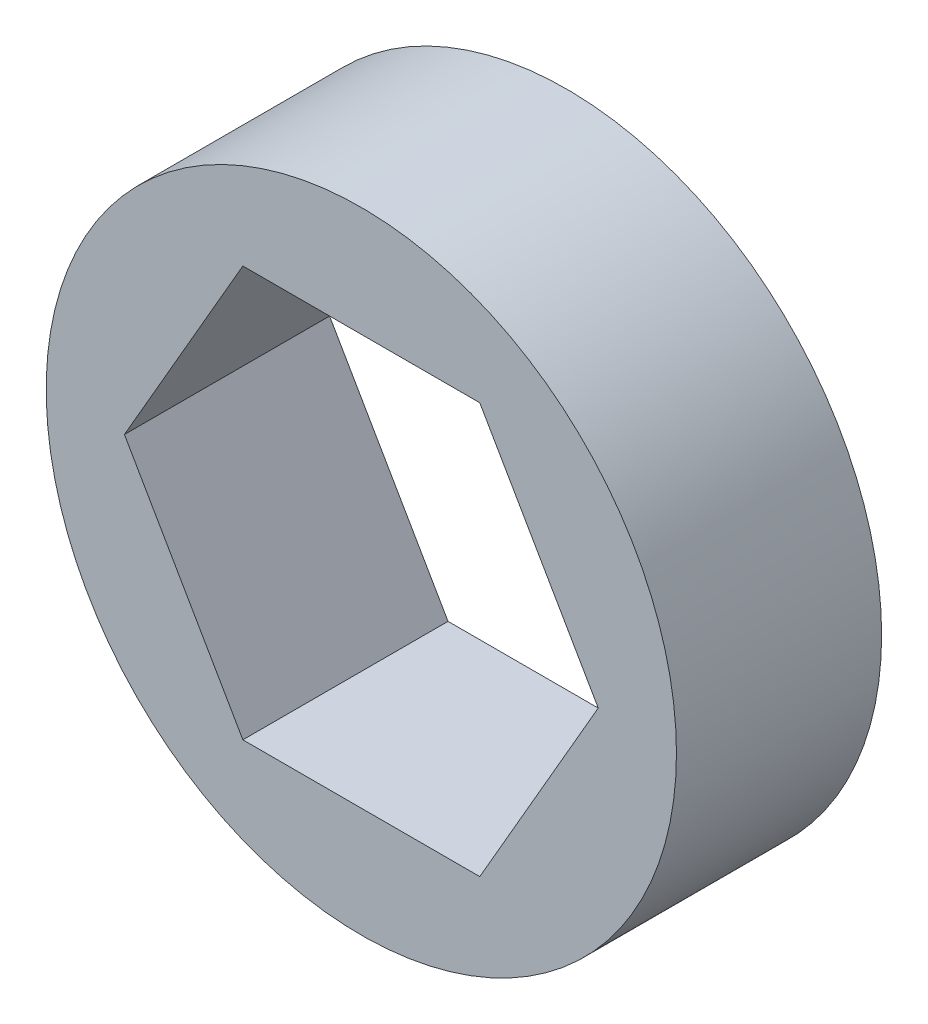
from build123d import *

# Parameters (mm, degrees)
SKETCH1_R           = 9.7536
BOSS_EXTRUDE1_DEPTH = 6.35


with BuildPart() as part:
    # Sketch1 → Boss-Extrude1 (new body)
    with BuildSketch(Plane.XY):
        Circle(SKETCH1_R)
        Polygon((-7.332348419, 0), (-3.666174209, -6.35), (3.666174209, -6.35), (7.332348419, 0), (3.666174209, 6.35), (-3.666174209, 6.35), align=None, mode=Mode.SUBTRACT)
    extrude(amount=BOSS_EXTRUDE1_DEPTH)


solid = part.part
